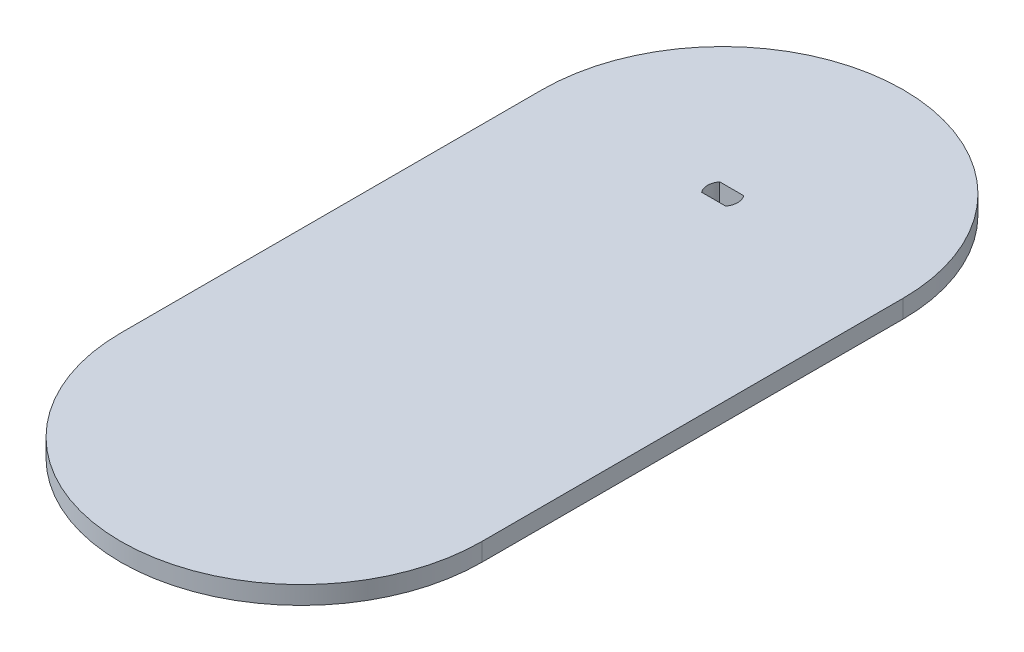
from build123d import *

# Parameters (mm, degrees)
BOSS_EXTRUDE1_DEPTH = 3


with BuildPart() as part:
    # Sketch1 → Boss-Extrude1 (new body)
    with BuildSketch(Plane(origin=(0, 0, 0), x_dir=(1, 0, 0), z_dir=(0, 1, 0))):
        with BuildLine():
            Line((-30, 0), (-30, -70))
            ThreePointArc((-30, -70), (0, -100), (30, -70))
            Line((30, -70), (30, 0))
            ThreePointArc((30, 0), (0, 30), (-30, 0))
        make_face()
        with BuildLine():
            Line((2, -1.5), (-2, -1.5))
            ThreePointArc((-2, -1.5), (-2.5, 0), (-2, 1.5))
            Line((-2, 1.5), (2, 1.5))
            ThreePointArc((2, 1.5), (2.5, 0), (2, -1.5))
        make_face(mode=Mode.SUBTRACT)
    extrude(amount=BOSS_EXTRUDE1_DEPTH)


solid = part.part
